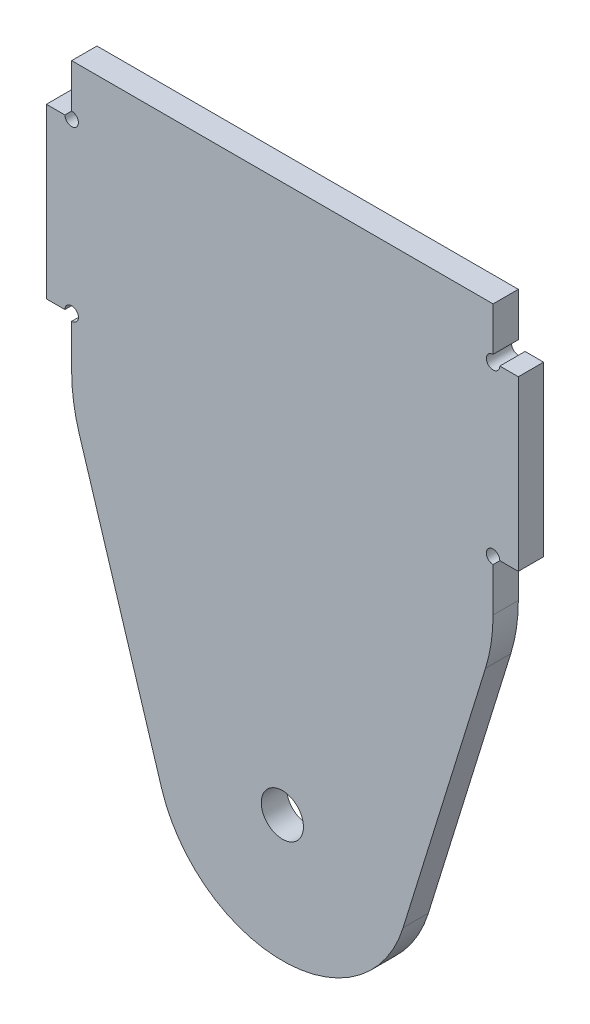
from build123d import *

# Parameters (mm, degrees)
SKETCH1_W           = 50
SKETCH1_H           = 35
SKETCH1_R           = 2.5
BOSS_EXTRUDE1_DEPTH = 3
FILLET1_R           = 20
SKETCH2_W           = 6
SKETCH2_H           = 20
BOSS_EXTRUDE2_DEPTH = 3
SKETCH3_R           = 0.8
CUT_EXTRUDE1_DEPTH  = 69.551075849


with BuildPart() as part:
    # Sketch1 → Boss-Extrude1 (new body)
    # profile 1 of 2: a face of its own
    with BuildSketch(Plane.XY):
        Rectangle(SKETCH1_W, SKETCH1_H)
    # profile 2 of 2: a face of its own
    with BuildSketch(Plane.XY):
        with BuildLine():
            Line((-25, -17.5), (-14.327856223, -51.939880186))
            ThreePointArc((-14.327856223, -51.939880186), (0, -62.5), (14.327856223, -51.939880186))
            Line((14.327856223, -51.939880186), (25, -17.5))
            Line((25, -17.5), (-25, -17.5))
        make_face()
        with Locations((0, -47.5)):
            Circle(SKETCH1_R, mode=Mode.SUBTRACT)
    extrude(amount=BOSS_EXTRUDE1_DEPTH)

    # Fillet1
    fillet1_edges = [part.edges().sort_by_distance(p)[0] for p in [
        (25, -17.5, 1.5),
        (-25, -17.5, 1.5),
    ]]
    fillet(fillet1_edges, radius=FILLET1_R)

    # Sketch2 → Boss-Extrude2 (add)
    with BuildSketch(Plane.XY.offset(3)):
        with Locations((-25, 1.513878189)):
            Rectangle(SKETCH2_W, SKETCH2_H)
        with Locations((25, 1.513878189)):
            Rectangle(SKETCH2_W, SKETCH2_H)
    extrude(amount=-BOSS_EXTRUDE2_DEPTH)

    # Sketch3 → Cut-Extrude1 (cut, through all)
    with BuildSketch(Plane.XY.offset(3)):
        with Locations((-25, 11.513878189)):
            Circle(SKETCH3_R)
        with Locations((-25, -8.486121811)):
            Circle(SKETCH3_R)
        with Locations((25, 11.513878189)):
            Circle(SKETCH3_R)
        with Locations((25, -8.486121811)):
            Circle(SKETCH3_R)
    extrude(amount=-CUT_EXTRUDE1_DEPTH, mode=Mode.SUBTRACT)


solid = part.part
